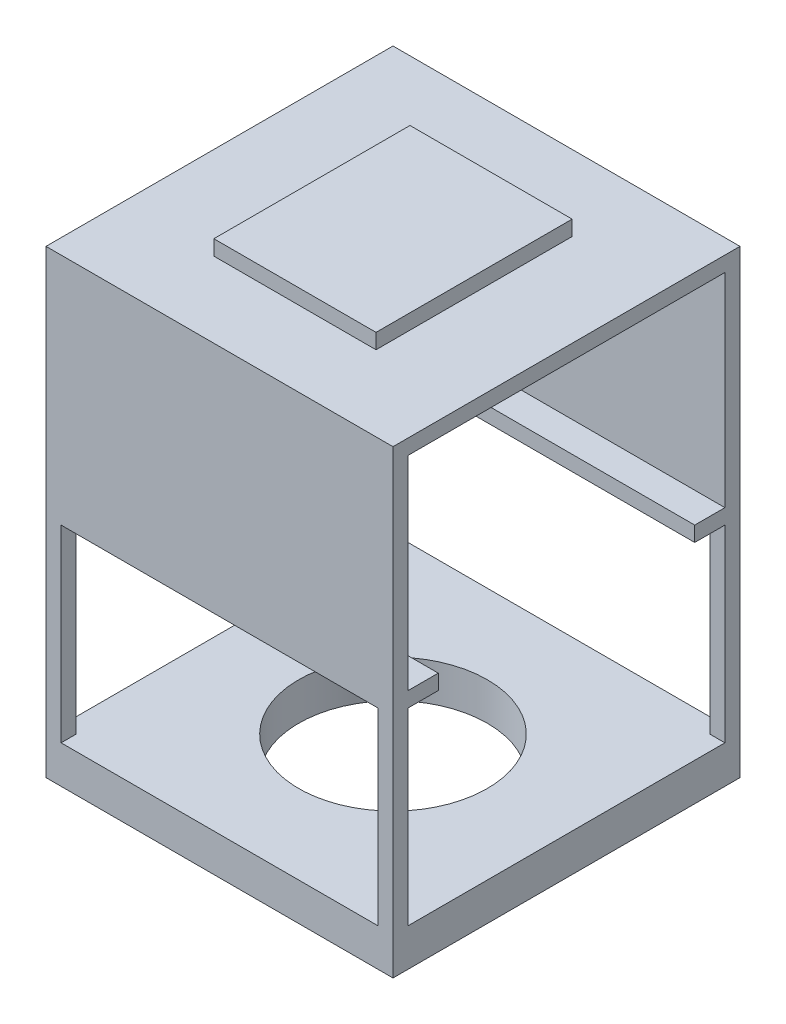
from build123d import *

# Parameters (mm, degrees)
CROQUIS1_W              = 21.5
CROQUIS1_H              = 26
SALIENTE_EXTRUIR1_DEPTH = 2
CROQUIS2_W              = 46
CROQUIS2_H              = 46
SALIENTE_EXTRUIR2_DEPTH = 2
CROQUIS3_W              = 46
CROQUIS3_H              = 46
CROQUIS3_W_2            = 42
CROQUIS3_H_2            = 42
SALIENTE_EXTRUIR3_DEPTH = 29
CROQUIS4_W              = 42
CROQUIS4_H              = 29
CORTAR_EXTRUIR1_DEPTH   = 29
SALIENTE_EXTRUIR4_DEPTH = 2
CROQUIS6_W              = 2
CROQUIS6_H              = 2
SALIENTE_EXTRUIR5_DEPTH = 30
CROQUIS7_W              = 46
CROQUIS7_H              = 46
SALIENTE_EXTRUIR6_DEPTH = 5
CROQUIS8_R              = 12.5
CORTAR_EXTRUIR2_DEPTH   = 30


with BuildPart() as part:
    # Croquis1 → Saliente-Extruir1 (new body)
    with BuildSketch(Plane(origin=(0, 0, 0), x_dir=(1, 0, 0), z_dir=(0, 1, 0))):
        Rectangle(CROQUIS1_W, CROQUIS1_H)
    extrude(amount=SALIENTE_EXTRUIR1_DEPTH)

    # Croquis2 → Saliente-Extruir2 (add)
    with BuildSketch(Plane.XZ):
        Rectangle(CROQUIS2_W, CROQUIS2_H)
    extrude(amount=SALIENTE_EXTRUIR2_DEPTH)

    # Croquis3 → Saliente-Extruir3 (add)
    with BuildSketch(Plane.XZ.offset(2)):
        Rectangle(CROQUIS3_W, CROQUIS3_H)
        Rectangle(CROQUIS3_W_2, CROQUIS3_H_2, mode=Mode.SUBTRACT)
    extrude(amount=SALIENTE_EXTRUIR3_DEPTH)

    # Croquis4 → Cortar-Extruir1 (cut)
    with BuildSketch(Plane(origin=(23, 0, 0), x_dir=(0, 0, -1), z_dir=(1, 0, 0))):
        with Locations((0, -16.5)):
            Rectangle(CROQUIS4_W, CROQUIS4_H)
    extrude(amount=-CORTAR_EXTRUIR1_DEPTH, mode=Mode.SUBTRACT)

    # Croquis5 → Saliente-Extruir4 (add)
    with BuildSketch(Plane.XZ.offset(31)):
        Polygon((23, 17), (-17, 17), (-17, -17), (23, -17), (23, -23), (-23, -23), (-23, 23), (23, 23), align=None)
    extrude(amount=-SALIENTE_EXTRUIR4_DEPTH)

    # Croquis6 → Saliente-Extruir5 (add)
    with BuildSketch(Plane.XZ.offset(31)):
        with Locations((-22, 22)):
            Rectangle(CROQUIS6_W, CROQUIS6_H)
        with Locations((22, 22)):
            Rectangle(CROQUIS6_W, CROQUIS6_H)
        with Locations((-22, -22)):
            Rectangle(CROQUIS6_W, CROQUIS6_H)
        with Locations((22, -22)):
            Rectangle(CROQUIS6_W, CROQUIS6_H)
    extrude(amount=SALIENTE_EXTRUIR5_DEPTH)

    # Croquis7 → Saliente-Extruir6 (add)
    with BuildSketch(Plane.XZ.offset(61)):
        Rectangle(CROQUIS7_W, CROQUIS7_H)
    extrude(amount=-SALIENTE_EXTRUIR6_DEPTH)

    # Croquis8 → Cortar-Extruir2 (cut)
    with BuildSketch(Plane.XZ.offset(61)):
        with Locations(Location((0, 0, 0), (0, 0, 270))):
            Circle(CROQUIS8_R)
    extrude(amount=-CORTAR_EXTRUIR2_DEPTH, mode=Mode.SUBTRACT)


solid = part.part
